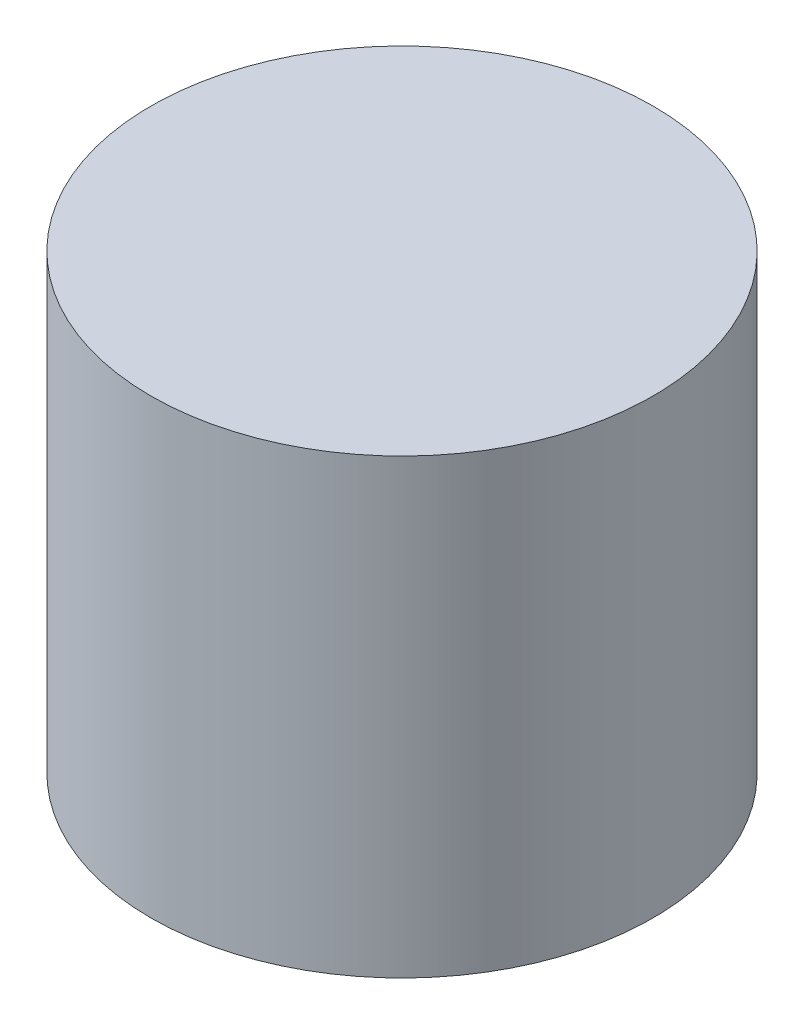
from build123d import *

# Parameters (mm, degrees)
ESBO_O1_W = 20
ESBO_O1_H = 36


with BuildPart() as part:
    # Esboço1 → Revolução1 (revolve)
    with BuildSketch(Plane.XY, mode=Mode.PRIVATE) as revolu_o1_sk:
        with Locations((10, 18)):
            Rectangle(ESBO_O1_W, ESBO_O1_H)
    revolve(revolu_o1_sk.sketch.rotate(Axis((0, 0, 0), (0, 1, 0)), 90), axis=Axis((0, 0, 0), (0, 1, 0)))


solid = part.part
